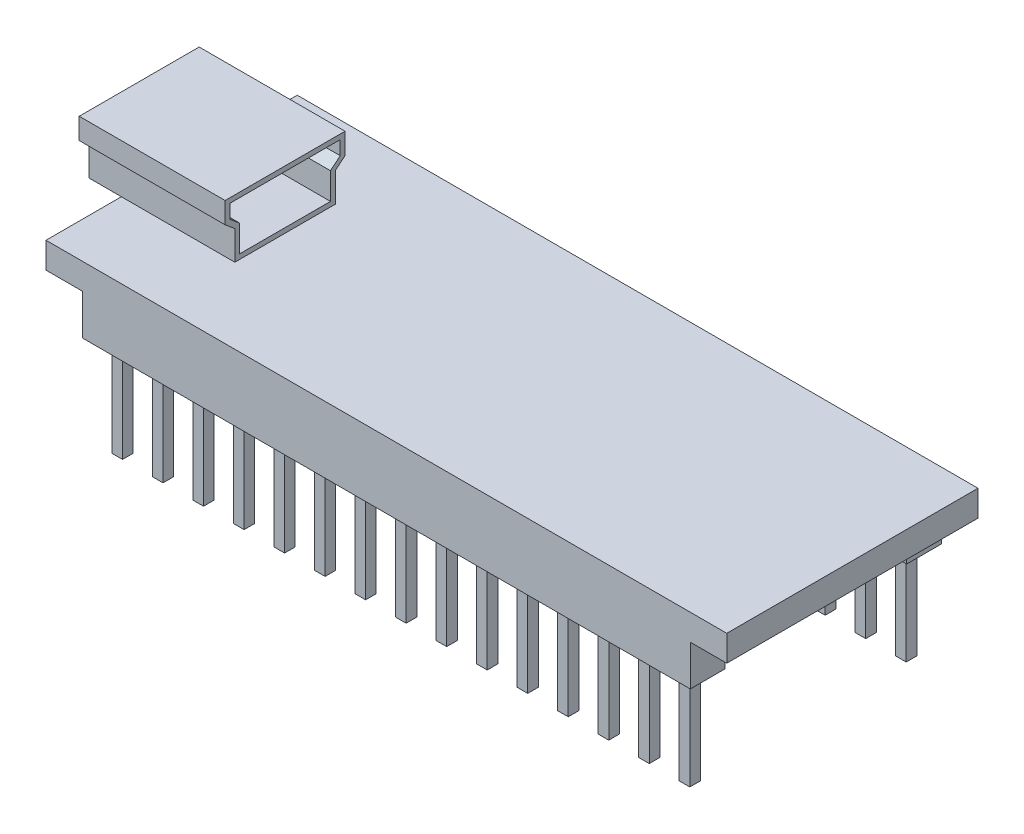
from build123d import *

# Parameters (mm, degrees)
SKETCH1_W                = 42
SKETCH1_H                = 15.5
BOSS_EXTRUDE1_DEPTH      = 1.6
EXTRUDE_THIN1_START      = -7
EXTRUDE_THIN1_DEPTH      = 9
SKETCH3_W                = 18.75
SKETCH3_H                = 2.148280867
BOSS_EXTRUDE2_DEPTH      = 2.5
SKETCH4_W                = 0.654719532
SKETCH4_H                = 0.654719531
BOSS_EXTRUDE3_DEPTH      = 6
LPATTERN1_COUNT          = 15
LPATTERN1_PITCH          = 2.5
MIRROR4_COPY_1_SKETCH_W  = 0.654719532
MIRROR4_COPY_1_SKETCH_H  = 0.654719531
MIRROR4_COPY_1_DEPTH     = 6
MIRROR4_COPY_2_SKETCH_W  = 0.654719532
MIRROR4_COPY_2_SKETCH_H  = 0.654719531
MIRROR4_COPY_2_DEPTH     = 6
MIRROR4_COPY_3_SKETCH_W  = 0.654719532
MIRROR4_COPY_3_SKETCH_H  = 0.654719531
MIRROR4_COPY_3_DEPTH     = 6
MIRROR4_COPY_4_SKETCH_W  = 0.654719532
MIRROR4_COPY_4_SKETCH_H  = 0.654719531
MIRROR4_COPY_4_DEPTH     = 6
MIRROR4_COPY_5_SKETCH_W  = 0.654719532
MIRROR4_COPY_5_SKETCH_H  = 0.654719531
MIRROR4_COPY_5_DEPTH     = 6
MIRROR4_COPY_6_SKETCH_W  = 0.654719532
MIRROR4_COPY_6_SKETCH_H  = 0.654719531
MIRROR4_COPY_6_DEPTH     = 6
MIRROR4_COPY_7_SKETCH_W  = 0.654719532
MIRROR4_COPY_7_SKETCH_H  = 0.654719531
MIRROR4_COPY_7_DEPTH     = 6
MIRROR4_COPY_8_SKETCH_W  = 0.654719532
MIRROR4_COPY_8_SKETCH_H  = 0.654719531
MIRROR4_COPY_8_DEPTH     = 6
MIRROR4_COPY_9_SKETCH_W  = 0.654719532
MIRROR4_COPY_9_SKETCH_H  = 0.654719531
MIRROR4_COPY_9_DEPTH     = 6
MIRROR4_COPY_10_SKETCH_W = 0.654719532
MIRROR4_COPY_10_SKETCH_H = 0.654719531
MIRROR4_COPY_10_DEPTH    = 6
MIRROR4_COPY_11_SKETCH_W = 0.654719532
MIRROR4_COPY_11_SKETCH_H = 0.654719531
MIRROR4_COPY_11_DEPTH    = 6
MIRROR4_COPY_12_SKETCH_W = 0.654719532
MIRROR4_COPY_12_SKETCH_H = 0.654719531
MIRROR4_COPY_12_DEPTH    = 6
MIRROR4_COPY_13_SKETCH_W = 0.654719532
MIRROR4_COPY_13_SKETCH_H = 0.654719531
MIRROR4_COPY_13_DEPTH    = 6
MIRROR4_COPY_14_SKETCH_W = 0.654719532
MIRROR4_COPY_14_SKETCH_H = 0.654719531
MIRROR4_COPY_14_DEPTH    = 6


with BuildPart() as part:
    # Sketch1 → Boss-Extrude1 (new body)
    with BuildSketch(Plane(origin=(0, 0, 0), x_dir=(1, 0, 0), z_dir=(0, 1, 0))):
        with Locations((21, 7.75)):
            Rectangle(SKETCH1_W, SKETCH1_H)
    extrude(amount=BOSS_EXTRUDE1_DEPTH)

    # Sketch2 → Extrude-Thin1 (add)
    with BuildSketch(Plane.ZY.offset(EXTRUDE_THIN1_START)):
        Polygon((-7.75, 1.6), (-10.85, 1.6), (-10.85, 3.4), (-11.45, 3.9), (-11.45, 5.2), (-7.75, 5.2), (-7.75, 4.9), (-11.15, 4.9), (-11.15, 4.040512484), (-10.55, 3.540512484), (-10.55, 1.9), (-7.75, 1.9), align=None)
    extrude_thin1 = extrude(amount=EXTRUDE_THIN1_DEPTH)

    # Mirror1: Extrude-Thin1 across plane
    add(extrude_thin1.mirror(Plane.XY.offset(-7.75)))

    # Sketch3 → Boss-Extrude2 (add)
    with BuildSketch(Plane.XZ):
        with Locations((11.625, -1.074140433)):
            Rectangle(SKETCH3_W, SKETCH3_H)
        with Locations((30.375, -1.074140433)):
            Rectangle(SKETCH3_W, SKETCH3_H)
    boss_extrude2 = extrude(amount=BOSS_EXTRUDE2_DEPTH)

    # Sketch4 → Boss-Extrude3 (add)
    with BuildSketch(Plane.XZ.offset(2.5)):
        with Locations((3.64534799, -1.074140433)):
            Rectangle(SKETCH4_W, SKETCH4_H)
    boss_extrude3 = extrude(amount=BOSS_EXTRUDE3_DEPTH)

    # LPattern1: Boss-Extrude3 ×15
    with Locations(*[(i * LPATTERN1_PITCH, 0, 0) for i in range(1, LPATTERN1_COUNT)]):
        add(boss_extrude3)

    # Mirror3: Boss-Extrude2 across plane
    add(boss_extrude2.mirror(Plane.XY.offset(-7.75)))

    # Mirror4: Boss-Extrude3 across plane
    add(boss_extrude3.mirror(Plane.XY.offset(-7.75)))

    # Mirror4 copy 1 sketch → Mirror4 copy 1 (add)
    with BuildSketch(Plane(origin=(2.5, -2.5, -15.5), x_dir=(1, 0, 0), z_dir=(0, -1, 0))):
        with Locations((3.64534799, 1.074140433)):
            Rectangle(MIRROR4_COPY_1_SKETCH_W, MIRROR4_COPY_1_SKETCH_H)
    extrude(amount=MIRROR4_COPY_1_DEPTH)

    # Mirror4 copy 2 sketch → Mirror4 copy 2 (add)
    with BuildSketch(Plane(origin=(5, -2.5, -15.5), x_dir=(1, 0, 0), z_dir=(0, -1, 0))):
        with Locations((3.64534799, 1.074140433)):
            Rectangle(MIRROR4_COPY_2_SKETCH_W, MIRROR4_COPY_2_SKETCH_H)
    extrude(amount=MIRROR4_COPY_2_DEPTH)

    # Mirror4 copy 3 sketch → Mirror4 copy 3 (add)
    with BuildSketch(Plane(origin=(7.5, -2.5, -15.5), x_dir=(1, 0, 0), z_dir=(0, -1, 0))):
        with Locations((3.64534799, 1.074140433)):
            Rectangle(MIRROR4_COPY_3_SKETCH_W, MIRROR4_COPY_3_SKETCH_H)
    extrude(amount=MIRROR4_COPY_3_DEPTH)

    # Mirror4 copy 4 sketch → Mirror4 copy 4 (add)
    with BuildSketch(Plane(origin=(10, -2.5, -15.5), x_dir=(1, 0, 0), z_dir=(0, -1, 0))):
        with Locations((3.64534799, 1.074140433)):
            Rectangle(MIRROR4_COPY_4_SKETCH_W, MIRROR4_COPY_4_SKETCH_H)
    extrude(amount=MIRROR4_COPY_4_DEPTH)

    # Mirror4 copy 5 sketch → Mirror4 copy 5 (add)
    with BuildSketch(Plane(origin=(12.5, -2.5, -15.5), x_dir=(1, 0, 0), z_dir=(0, -1, 0))):
        with Locations((3.64534799, 1.074140433)):
            Rectangle(MIRROR4_COPY_5_SKETCH_W, MIRROR4_COPY_5_SKETCH_H)
    extrude(amount=MIRROR4_COPY_5_DEPTH)

    # Mirror4 copy 6 sketch → Mirror4 copy 6 (add)
    with BuildSketch(Plane(origin=(15, -2.5, -15.5), x_dir=(1, 0, 0), z_dir=(0, -1, 0))):
        with Locations((3.64534799, 1.074140433)):
            Rectangle(MIRROR4_COPY_6_SKETCH_W, MIRROR4_COPY_6_SKETCH_H)
    extrude(amount=MIRROR4_COPY_6_DEPTH)

    # Mirror4 copy 7 sketch → Mirror4 copy 7 (add)
    with BuildSketch(Plane(origin=(17.5, -2.5, -15.5), x_dir=(1, 0, 0), z_dir=(0, -1, 0))):
        with Locations((3.64534799, 1.074140433)):
            Rectangle(MIRROR4_COPY_7_SKETCH_W, MIRROR4_COPY_7_SKETCH_H)
    extrude(amount=MIRROR4_COPY_7_DEPTH)

    # Mirror4 copy 8 sketch → Mirror4 copy 8 (add)
    with BuildSketch(Plane(origin=(20, -2.5, -15.5), x_dir=(1, 0, 0), z_dir=(0, -1, 0))):
        with Locations((3.64534799, 1.074140433)):
            Rectangle(MIRROR4_COPY_8_SKETCH_W, MIRROR4_COPY_8_SKETCH_H)
    extrude(amount=MIRROR4_COPY_8_DEPTH)

    # Mirror4 copy 9 sketch → Mirror4 copy 9 (add)
    with BuildSketch(Plane(origin=(22.5, -2.5, -15.5), x_dir=(1, 0, 0), z_dir=(0, -1, 0))):
        with Locations((3.64534799, 1.074140433)):
            Rectangle(MIRROR4_COPY_9_SKETCH_W, MIRROR4_COPY_9_SKETCH_H)
    extrude(amount=MIRROR4_COPY_9_DEPTH)

    # Mirror4 copy 10 sketch → Mirror4 copy 10 (add)
    with BuildSketch(Plane(origin=(25, -2.5, -15.5), x_dir=(1, 0, 0), z_dir=(0, -1, 0))):
        with Locations((3.64534799, 1.074140433)):
            Rectangle(MIRROR4_COPY_10_SKETCH_W, MIRROR4_COPY_10_SKETCH_H)
    extrude(amount=MIRROR4_COPY_10_DEPTH)

    # Mirror4 copy 11 sketch → Mirror4 copy 11 (add)
    with BuildSketch(Plane(origin=(27.5, -2.5, -15.5), x_dir=(1, 0, 0), z_dir=(0, -1, 0))):
        with Locations((3.64534799, 1.074140433)):
            Rectangle(MIRROR4_COPY_11_SKETCH_W, MIRROR4_COPY_11_SKETCH_H)
    extrude(amount=MIRROR4_COPY_11_DEPTH)

    # Mirror4 copy 12 sketch → Mirror4 copy 12 (add)
    with BuildSketch(Plane(origin=(30, -2.5, -15.5), x_dir=(1, 0, 0), z_dir=(0, -1, 0))):
        with Locations((3.64534799, 1.074140433)):
            Rectangle(MIRROR4_COPY_12_SKETCH_W, MIRROR4_COPY_12_SKETCH_H)
    extrude(amount=MIRROR4_COPY_12_DEPTH)

    # Mirror4 copy 13 sketch → Mirror4 copy 13 (add)
    with BuildSketch(Plane(origin=(32.5, -2.5, -15.5), x_dir=(1, 0, 0), z_dir=(0, -1, 0))):
        with Locations((3.64534799, 1.074140433)):
            Rectangle(MIRROR4_COPY_13_SKETCH_W, MIRROR4_COPY_13_SKETCH_H)
    extrude(amount=MIRROR4_COPY_13_DEPTH)

    # Mirror4 copy 14 sketch → Mirror4 copy 14 (add)
    with BuildSketch(Plane(origin=(35, -2.5, -15.5), x_dir=(1, 0, 0), z_dir=(0, -1, 0))):
        with Locations((3.64534799, 1.074140433)):
            Rectangle(MIRROR4_COPY_14_SKETCH_W, MIRROR4_COPY_14_SKETCH_H)
    extrude(amount=MIRROR4_COPY_14_DEPTH)


solid = part.part
